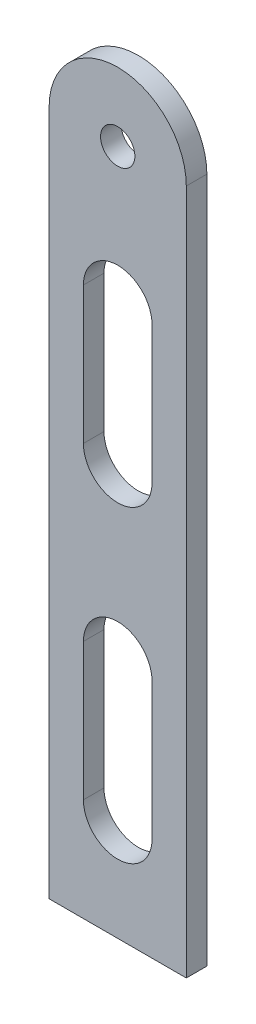
from build123d import *

# Parameters (mm, degrees)
SKETCH1_R           = 2.5
BOSS_EXTRUDE1_DEPTH = 3


with BuildPart() as part:
    # Sketch1 → Boss-Extrude1 (new body)
    with BuildSketch(Plane.XY):
        with BuildLine():
            Line((10, 0), (10, -100))
            Line((10, -100), (-10, -100))
            Line((-10, -100), (-10, 0))
            ThreePointArc((-10, 0), (0, 10), (10, 0))
        make_face()
        Circle(SKETCH1_R, mode=Mode.SUBTRACT)
        with BuildLine():
            Line((5, -20), (5, -40))
            ThreePointArc((5, -40), (0, -45), (-5, -40))
            Line((-5, -40), (-5, -20))
            ThreePointArc((-5, -20), (0, -15), (5, -20))
        make_face(mode=Mode.SUBTRACT)
        with BuildLine():
            Line((-5, -85), (-5, -65))
            ThreePointArc((-5, -65), (0, -60), (5, -65))
            Line((5, -65), (5, -85))
            ThreePointArc((5, -85), (0, -90), (-5, -85))
        make_face(mode=Mode.SUBTRACT)
    extrude(amount=BOSS_EXTRUDE1_DEPTH)


solid = part.part
